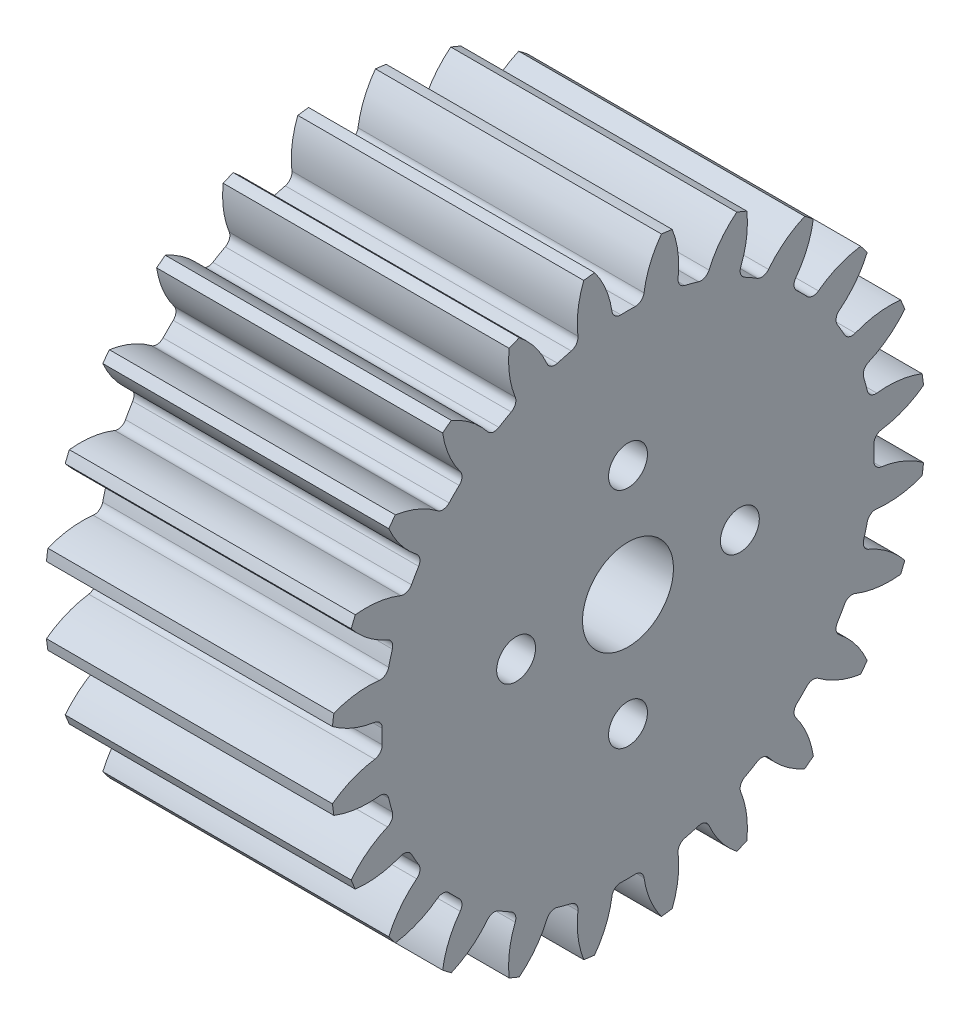
from build123d import *

# Parameters (mm, degrees)
SKETCH1_R                = 26
SKETCH1_R_2              = 3.975
BOSS_EXTRUDE2_DEPTH      = 25
CUT_EXTRUDE1_DEPTH       = 45.463468151
FILLET1_R                = 0.76
CIRPATTERN2_COUNT        = 24
FILLET1_OF_CIRPATTERN2_R = 0.76
SKETCH4_R                = 1.7
CUT_EXTRUDE2_DEPTH       = 10


with BuildPart() as part:
    # Sketch1 → Boss-Extrude2 (new body)
    with BuildSketch(Plane(origin=(0, 0, 0), x_dir=(0, 0, -1), z_dir=(1, 0, 0))):
        Circle(SKETCH1_R)
        Circle(SKETCH1_R_2, mode=Mode.SUBTRACT)
    extrude(amount=BOSS_EXTRUDE2_DEPTH)

    # Sketch3 → Cut-Extrude1 (cut, through all)
    with BuildSketch(Plane(origin=(25, 0, 0), x_dir=(0, 0, -1), z_dir=(1, 0, 0))):
        with BuildLine():
            ThreePointArc((1.328830873, 21.45889579), (0, 21.5), (-1.328830873, 21.45889579))
            ThreePointArc((-1.328830873, 21.45889579), (-1.808846696, 23.762276238), (-2.921717655, 25.835316254))
            ThreePointArc((-2.921717655, 25.835316254), (0, 26), (2.921717655, 25.835316254))
            ThreePointArc((2.921717655, 25.835316254), (1.808846696, 23.762276238), (1.328830873, 21.45889579))
        make_face()
    cut_extrude1 = extrude(amount=-CUT_EXTRUDE1_DEPTH, mode=Mode.SUBTRACT)

    # Fillet1
    fillet1_edges = [part.edges().sort_by_distance(p)[0] for p in [
        (12.5, 21.45889579, 1.328830873),
        (12.5, 21.45889579, -1.328830873),
    ]]
    fillet(fillet1_edges, radius=FILLET1_R)

    # CirPattern2: Cut-Extrude1 ×24 about axis
    cirpattern2_axis = Axis((0, 0, 0), (1, 0, 0))
    for i in range(1, CIRPATTERN2_COUNT):
        add(cut_extrude1.rotate(cirpattern2_axis, i * 360 / CIRPATTERN2_COUNT), mode=Mode.SUBTRACT)

    # Fillet1 of CirPattern2
    fillet1_of_cirpattern2_edges = [part.edges().sort_by_distance(p)[0] for p in [
        (12.5, 20.383774909, 6.837522977),
        (12.5, 21.071628385, 4.270418858),
        (12.5, 17.919533454, 11.880249189),
        (12.5, 19.248364328, 9.578646601),
        (12.5, 14.234105408, 16.113356051),
        (12.5, 16.113356051, 14.234105408),
        (12.5, 9.578646601, 19.248364328),
        (12.5, 11.880249189, 17.919533454),
        (12.5, 4.270418858, 21.071628385),
        (12.5, 6.837522977, 20.383774909),
        (12.5, -1.328830873, 21.45889579),
        (12.5, 1.328830873, 21.45889579),
        (12.5, -6.837522977, 20.383774909),
        (12.5, -4.270418858, 21.071628385),
        (12.5, -11.880249189, 17.919533454),
        (12.5, -9.578646601, 19.248364328),
        (12.5, -16.113356051, 14.234105408),
        (12.5, -14.234105408, 16.113356051),
        (12.5, -19.248364328, 9.578646601),
        (12.5, -17.919533454, 11.880249189),
        (12.5, -21.071628385, 4.270418858),
        (12.5, -20.383774909, 6.837522977),
        (12.5, -21.45889579, -1.328830873),
        (12.5, -21.45889579, 1.328830873),
        (12.5, -20.383774909, -6.837522977),
        (12.5, -21.071628385, -4.270418858),
        (12.5, -17.919533454, -11.880249189),
        (12.5, -19.248364328, -9.578646601),
        (12.5, -14.234105408, -16.113356051),
        (12.5, -16.113356051, -14.234105408),
        (12.5, -9.578646601, -19.248364328),
        (12.5, -11.880249189, -17.919533454),
        (12.5, -4.270418858, -21.071628385),
        (12.5, -6.837522977, -20.383774909),
        (12.5, 1.328830873, -21.45889579),
        (12.5, -1.328830873, -21.45889579),
        (12.5, 6.837522977, -20.383774909),
        (12.5, 4.270418858, -21.071628385),
        (12.5, 11.880249189, -17.919533454),
        (12.5, 9.578646601, -19.248364328),
        (12.5, 16.113356051, -14.234105408),
        (12.5, 14.234105408, -16.113356051),
        (12.5, 19.248364328, -9.578646601),
        (12.5, 17.919533454, -11.880249189),
        (12.5, 21.071628385, -4.270418858),
        (12.5, 20.383774909, -6.837522977),
    ]]
    fillet(fillet1_of_cirpattern2_edges, radius=FILLET1_OF_CIRPATTERN2_R)

    # Sketch4 → Cut-Extrude2 (cut)
    with BuildSketch(Plane(origin=(25, 0, 0), x_dir=(0, 0, -1), z_dir=(1, 0, 0))):
        with Locations((0, 9.779)):
            Circle(SKETCH4_R)
        with Locations((9.779, 0)):
            Circle(SKETCH4_R)
        with Locations((0, -9.779)):
            Circle(SKETCH4_R)
        with Locations((-9.779, 0)):
            Circle(SKETCH4_R)
    extrude(amount=-CUT_EXTRUDE2_DEPTH, mode=Mode.SUBTRACT)


solid = part.part
